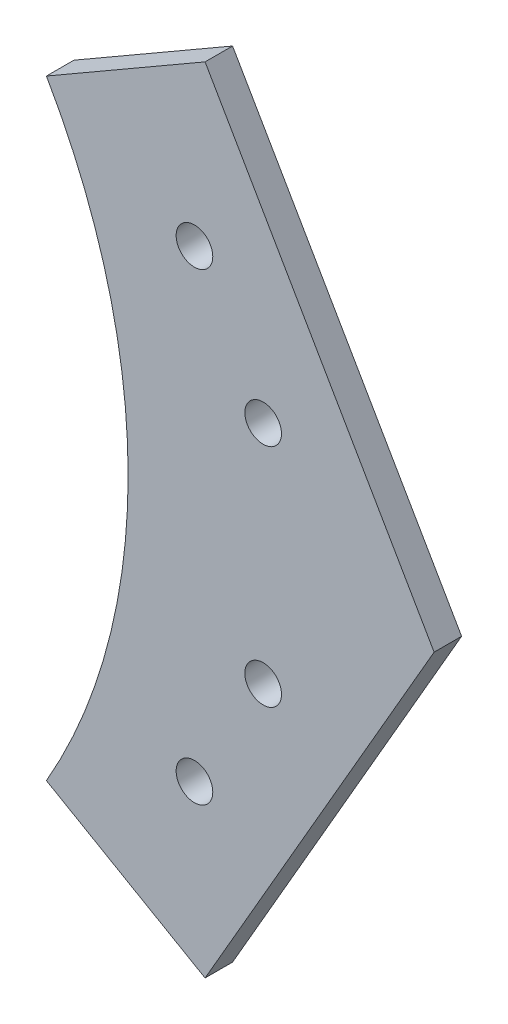
from build123d import *

# Parameters (mm, degrees)
SKETCH_1_R      = 2
EXTRUDE_1_DEPTH = 3


with BuildPart() as part:
    # 草图1 → 凸台-拉伸1 (new body)
    with BuildSketch(Plane.XY):
        with BuildLine():
            Line((30.874609077, -1.112961222), (5.874609077, 42.188308967))
            Line((5.874609077, 42.188308967), (-11.445898998, 32.188308967))
            ThreePointArc((-11.445898998, 32.188308967), (-2.522850544, -1.112961222), (-11.445898998, -34.414231411))
            Line((-11.445898998, -34.414231411), (5.874609077, -44.414231411))
            Line((5.874609077, -44.414231411), (30.874609077, -1.112961222))
        make_face()
        with Locations((4.714355039, -26.423850355)):
            Circle(SKETCH_1_R, mode=Mode.SUBTRACT)
        with Locations((12.214355039, -13.433469298)):
            Circle(SKETCH_1_R, mode=Mode.SUBTRACT)
        with Locations((12.214355039, 11.207546854)):
            Circle(SKETCH_1_R, mode=Mode.SUBTRACT)
        with Locations((4.714355039, 24.19792791)):
            Circle(SKETCH_1_R, mode=Mode.SUBTRACT)
    extrude(amount=EXTRUDE_1_DEPTH)


solid = part.part
